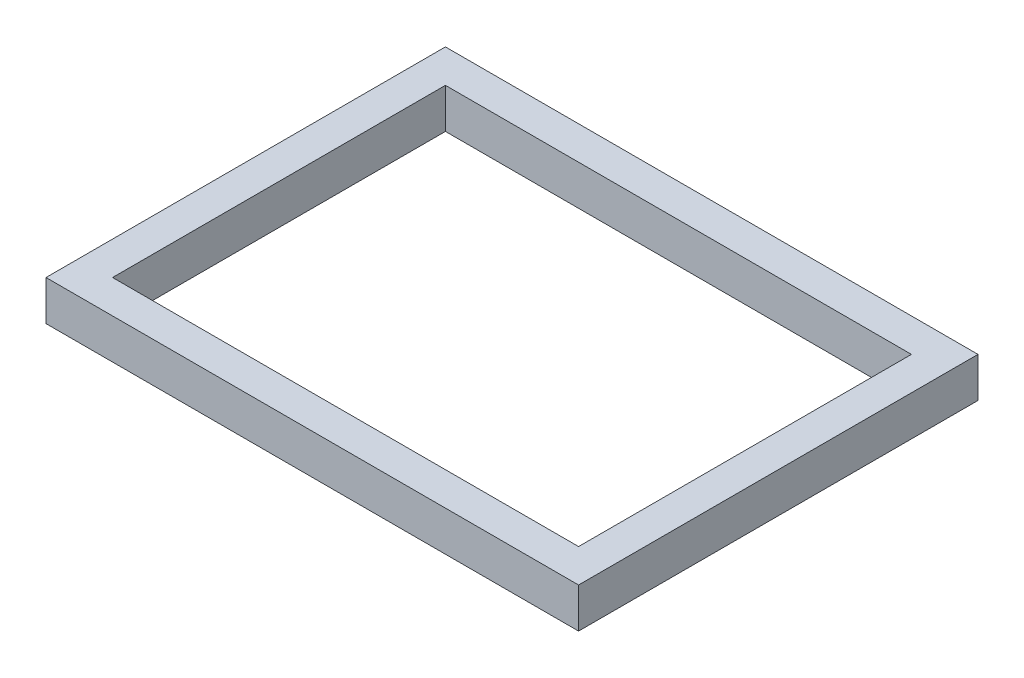
from build123d import *

# Parameters (mm, degrees)
SKETCH1_W           = 80
SKETCH1_H           = 60
SKETCH1_W_2         = 70
SKETCH1_H_2         = 50
BOSS_EXTRUDE1_DEPTH = 6


with BuildPart() as part:
    # Sketch1 → Boss-Extrude1 (new body)
    with BuildSketch(Plane(origin=(0, 0, 0), x_dir=(1, 0, 0), z_dir=(0, 1, 0))):
        with Locations((19.610198832, -19.019760054)):
            Rectangle(SKETCH1_W, SKETCH1_H)
        with Locations((19.610198832, -19.019760054)):
            Rectangle(SKETCH1_W_2, SKETCH1_H_2, mode=Mode.SUBTRACT)
    extrude(amount=BOSS_EXTRUDE1_DEPTH)


solid = part.part
